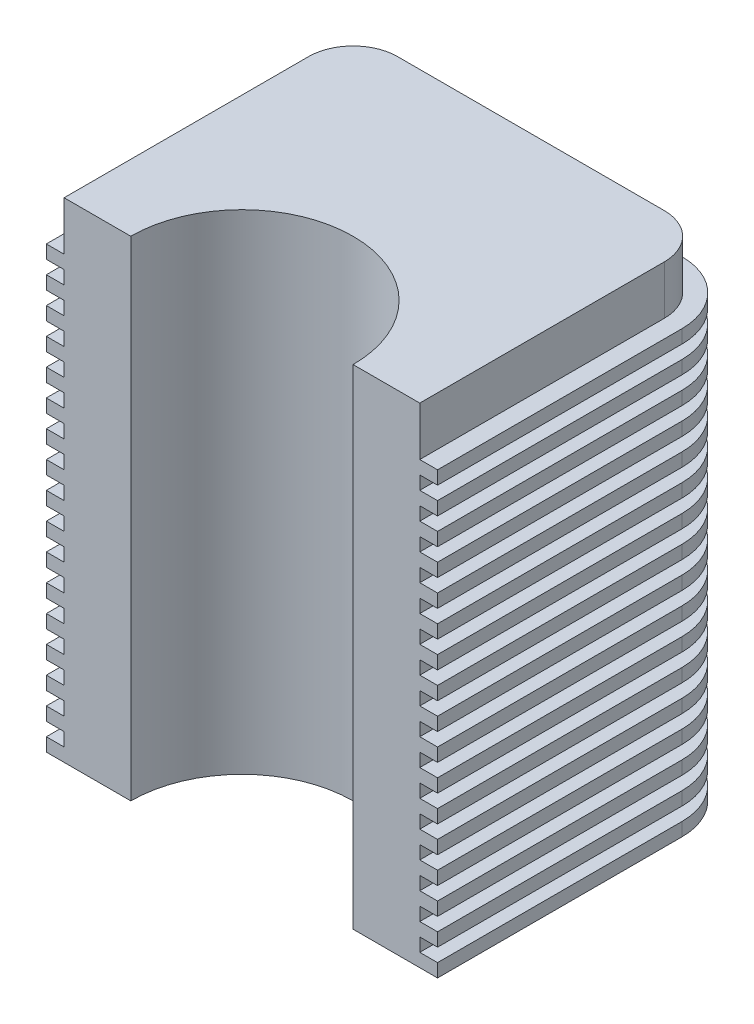
from build123d import *

# Parameters (mm, degrees)
BOSS_EXTRUDE2_DEPTH = 110
BOSS_EXTRUDE4_DEPTH = 3
LPATTERN1_COUNT     = 17
LPATTERN1_PITCH     = 6


with BuildPart() as part:
    # Sketch1 → Boss-Extrude2 (new body)
    with BuildSketch(Plane(origin=(0, 0, 0), x_dir=(1, 0, 0), z_dir=(0, 1, 0))):
        with BuildLine():
            Line((25, 0), (40, 0))
            Line((40, 0), (40, 55))
            ThreePointArc((40, 55), (37.071067812, 62.071067812), (30, 65))
            Line((30, 65), (-30, 65))
            ThreePointArc((-30, 65), (-37.071067812, 62.071067812), (-40, 55))
            Line((-40, 55), (-40, 0))
            Line((-40, 0), (-25, 0))
            ThreePointArc((-25, 0), (0, 25), (25, 0))
        make_face()
    extrude(amount=BOSS_EXTRUDE2_DEPTH)

    # Sketch3 → Boss-Extrude4 (add)
    with BuildSketch(Plane.XZ):
        with BuildLine():
            Line((-44, 0), (-44, -55))
            ThreePointArc((-44, -55), (-39.899494937, -64.899494937), (-30, -69))
            Line((-30, -69), (30, -69))
            ThreePointArc((30, -69), (39.899494937, -64.899494937), (44, -55))
            Line((44, -55), (44, 0))
            Line((44, 0), (40, 0))
            Line((40, 0), (40, -55))
            ThreePointArc((40, -55), (37.071067812, -62.071067812), (30, -65))
            Line((30, -65), (-30, -65))
            ThreePointArc((-30, -65), (-37.071067812, -62.071067812), (-40, -55))
            Line((-40, -55), (-40, 0))
            Line((-40, 0), (-44, 0))
        make_face()
    boss_extrude4 = extrude(amount=-BOSS_EXTRUDE4_DEPTH)

    # LPattern1: Boss-Extrude4 ×17
    with Locations(*[(0, i * LPATTERN1_PITCH, 0) for i in range(1, LPATTERN1_COUNT)]):
        add(boss_extrude4)


solid = part.part
